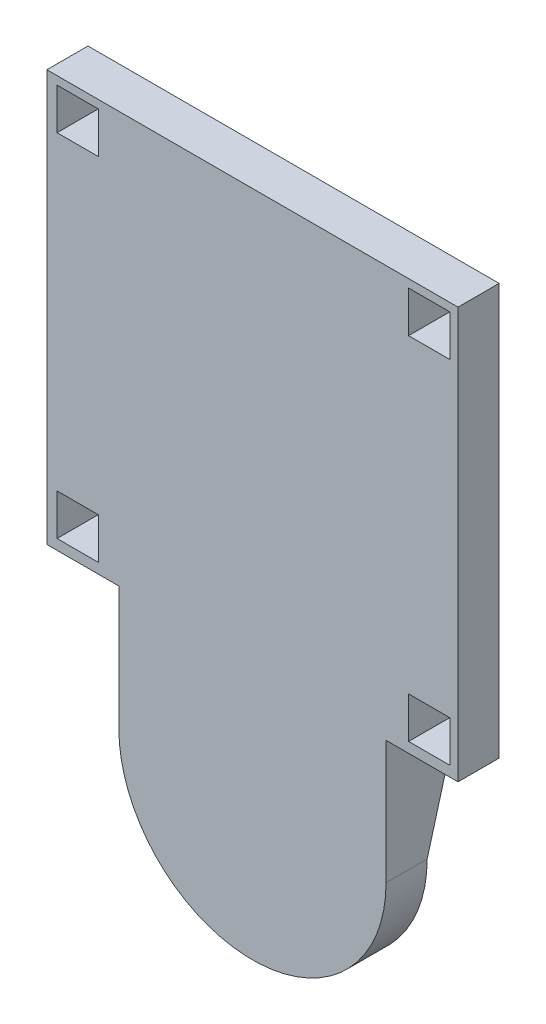
from build123d import *

# Parameters (mm, degrees)
SKETCH_1_W          = 200
SKETCH_1_H          = 200
EXTRUDE_1_DEPTH     = 10
SKETCH_2_W          = 20.05
SKETCH_2_H          = 20.05
CUT_EXTRUDE_2_DEPTH = 40
SKETCH_5_W          = 130
SKETCH_5_H          = 20
EXTRUDE_2_DEPTH     = 60
EXTRUDE_3_DEPTH     = 20
CUT_EXTRUDE_4_DEPTH = 16
SKETCH_10_W         = 110
SKETCH_10_H         = 10
EXTRUDE_5_DEPTH     = 38
EXTRUDE_6_DEPTH     = 10
EXTRUDE_7_DEPTH     = 120


with BuildPart() as part:
    # 草图1 → 凸台-拉伸1 (new, symmetric)
    with BuildSketch(Plane.XY):
        Rectangle(SKETCH_1_W, SKETCH_1_H)
    extrude(amount=EXTRUDE_1_DEPTH, both=True)

    # 草图2 → 切除-拉伸2 (cut)
    with BuildSketch(Plane(origin=(0, 0, -10), x_dir=(-1, 0, 0), z_dir=(0, 0, -1))):
        with Locations((-85.975, 85.975)):
            Rectangle(SKETCH_2_W, SKETCH_2_H)
        with Locations((85.025, 85.975)):
            Rectangle(SKETCH_2_W, SKETCH_2_H)
        with Locations((85.025, -84.975)):
            Rectangle(SKETCH_2_W, SKETCH_2_H)
        with Locations((-85.975, -84.975)):
            Rectangle(SKETCH_2_W, SKETCH_2_H)
    extrude(amount=-CUT_EXTRUDE_2_DEPTH, mode=Mode.SUBTRACT)

    # 草图5 → 凸台-拉伸2 (add)
    with BuildSketch(Plane.XZ.offset(100)):
        Rectangle(SKETCH_5_W, SKETCH_5_H)
    extrude(amount=EXTRUDE_2_DEPTH)

    # 草图6 → 凸台-拉伸3 (add)
    with BuildSketch(Plane(origin=(0, 0, -10), x_dir=(-1, 0, 0), z_dir=(0, 0, -1))):
        with BuildLine():
            Line((-65, -160), (65, -160))
            ThreePointArc((65, -160), (0, -225), (-65, -160))
        make_face()
    extrude(amount=-EXTRUDE_3_DEPTH)

    # 草图7 → 切除-拉伸4 (cut)
    with BuildSketch(Plane(origin=(0, 0, -10), x_dir=(-1, 0, 0), z_dir=(0, 0, -1))):
        with BuildLine():
            Line((-55, -100), (-55, -80.5))
            Line((-55, -80.5), (55, -80.5))
            Line((55, -80.5), (55, -100))
            Line((55, -100), (55, -160))
            ThreePointArc((55, -160), (0, -215), (-55, -160))
            Line((-55, -160), (-55, -100))
        make_face()
    extrude(amount=-CUT_EXTRUDE_4_DEPTH, mode=Mode.SUBTRACT)

    # 草图10 → 凸台-拉伸5 (add)
    with BuildSketch(Plane(origin=(0, 0, 6), x_dir=(-1, 0, 0), z_dir=(0, 0, -1))):
        with Locations((0, -85.5)):
            Rectangle(SKETCH_10_W, SKETCH_10_H)
    extrude(amount=EXTRUDE_5_DEPTH)

    # 草图11 → 凸台-拉伸6 (add)
    with BuildSketch(Plane(origin=(55, 0, 0), x_dir=(0, 0, -1), z_dir=(1, 0, 0))):
        Polygon((32, -80.5), (10, -80.5), (10, -160), align=None)
    extrude_6 = extrude(amount=EXTRUDE_6_DEPTH)

    # 镜向1: 凸台-拉伸6 across plane
    add(extrude_6.mirror(Plane(origin=(0, 0, 0), x_dir=(0, 0, 1), z_dir=(1, 0, 0))))

    # 草图12 → 凸台-拉伸7 (add)
    with BuildSketch(Plane(origin=(-55, 0, 0), x_dir=(0, 0, -1), z_dir=(1, 0, 0))):
        Polygon((-6, -125.5), (-6, -90.5), (23, -90.5), align=None)
    extrude(amount=EXTRUDE_7_DEPTH)


solid = part.part
